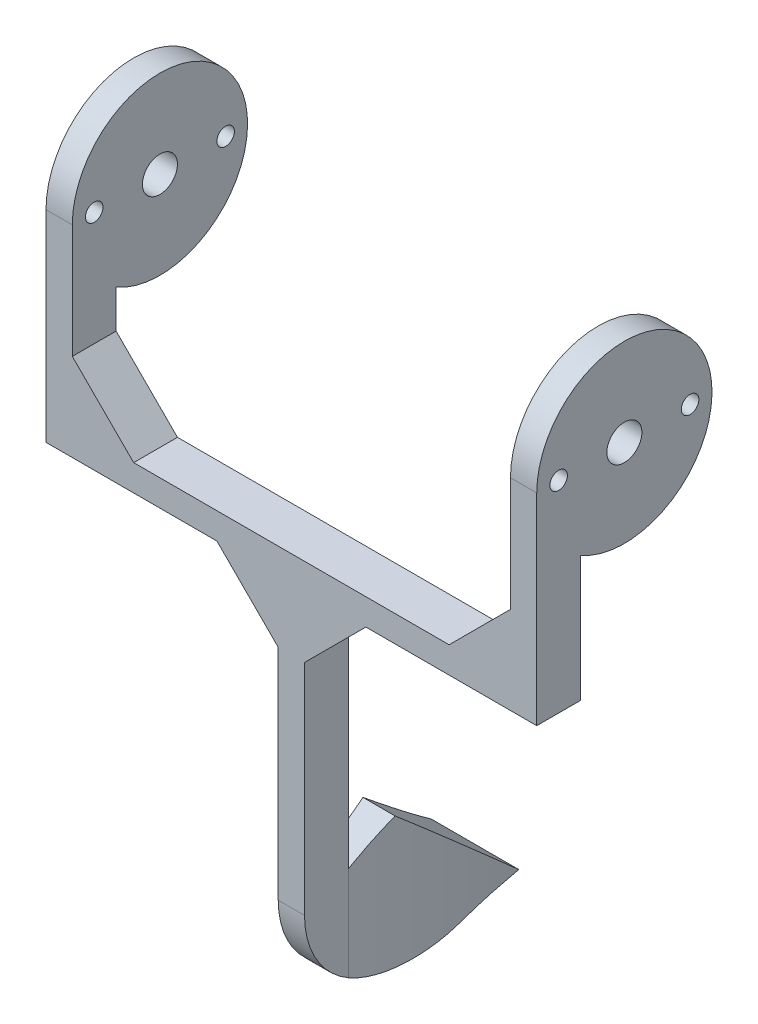
from build123d import *

# Parameters (mm, degrees)
BOSS_EXTRUDE1_DEPTH = 10
SKETCH2_OUTSIDE_W   = 35.602
SKETCH2_OUTSIDE_H   = 48.602
SKETCH2_OUTSIDE_R   = 2
CUT_EXTRUDE1_DEPTH  = 65.311741
SKETCH3_OUTSIDE_W   = 35.602
SKETCH3_OUTSIDE_H   = 48.602
CUT_EXTRUDE2_DEPTH  = 65.311741
BOSS_EXTRUDE2_DEPTH = 1.5
BOSS_EXTRUDE3_DEPTH = 5
SKETCH6_OUTSIDE_W   = 77.184
SKETCH6_OUTSIDE_H   = 42.134
CUT_EXTRUDE3_DEPTH  = 52.651745
SKETCH7_R           = 1
CUT_EXTRUDE4_DEPTH  = 73.669821
BOSS_EXTRUDE4_DEPTH = 5


with BuildPart() as part:
    # Sketch1 → Boss-Extrude1 (new, symmetric)
    with BuildSketch(Plane.XY):
        Polygon((0, 0), (-25, 0), (-25, 30), (-28, 30), (-28, -3), (0, -3), (28, -3), (28, 30), (25, 30), (25, 0), align=None)
    extrude(amount=BOSS_EXTRUDE1_DEPTH, both=True)

    # Sketch2 outside → Cut-Extrude1 (cut, through all)
    # profile 1 of 2: a face of its own
    with BuildSketch(Plane.ZY.offset(28)):
        with Locations((0, 13.5)):
            Rectangle(SKETCH2_OUTSIDE_W, SKETCH2_OUTSIDE_H)
        with BuildLine():
            Line((10, -3), (-10, -3))
            Line((-10, -3), (-10, 20))
            ThreePointArc((-10, 20), (0, 30), (10, 20))
            Line((10, 20), (10, -3))
        make_face(mode=Mode.SUBTRACT)
    # profile 2 of 2: a face of its own
    with BuildSketch(Plane.ZY.offset(28)):
        with Locations((0, 20)):
            Circle(SKETCH2_OUTSIDE_R)
    extrude(amount=-CUT_EXTRUDE1_DEPTH, mode=Mode.SUBTRACT)

    # Sketch3 outside → Cut-Extrude2 (cut, through all)
    with BuildSketch(Plane(origin=(28, 0, 0), x_dir=(0, 0, -1), z_dir=(1, 0, 0))):
        with Locations((0, 13.5)):
            Rectangle(SKETCH3_OUTSIDE_W, SKETCH3_OUTSIDE_H)
        with BuildLine():
            Line((-5, 11.339746), (-5, -3))
            Line((-5, -3), (-10, -3))
            Line((-10, -3), (-10, 20))
            ThreePointArc((-10, 20), (8.660254, 25), (-5, 11.339746))
        make_face(mode=Mode.SUBTRACT)
    extrude(amount=-CUT_EXTRUDE2_DEPTH, mode=Mode.SUBTRACT)

    # Sketch4 → Boss-Extrude2 (add, symmetric)
    with BuildSketch(Plane(origin=(0, 0, 0), x_dir=(0, 0, -1), z_dir=(1, 0, 0))):
        with BuildLine():
            Line((-10, -3), (-5, -3))
            Line((-5, -3), (-5, -32.886751))
            Line((-5, -32.886751), (0, -30))
            Line((0, -30), (0, -45))
            ThreePointArc((0, -45), (-7.071068, -42.071068), (-10, -35))
            Line((-10, -35), (-10, -3))
        make_face()
    extrude(amount=BOSS_EXTRUDE2_DEPTH, both=True)

    # Sketch5 → Boss-Extrude3 (add, symmetric)
    with BuildSketch(Plane(origin=(0, 0, 0), x_dir=(0, 0, -1), z_dir=(1, 0, 0))):
        with BuildLine():
            Line((0, -30), (-5, -32.886751))
            Line((-5, -32.886751), (-10, -32.886751))
            Line((-10, -32.886751), (-10, -35))
            ThreePointArc((-10, -35), (-4.414566, -43.972826), (6.102322, -42.922226))
            Line((6.102322, -42.922226), (10.950014, -39.188153))
            Line((10.950014, -39.188153), (0, -30))
        make_face()
    extrude(amount=BOSS_EXTRUDE3_DEPTH, both=True)

    # Sketch6 outside → Cut-Extrude3 (cut, through all)
    with BuildSketch(Plane.XZ.offset(3)):
        with Locations((0, -0.475)):
            Rectangle(SKETCH6_OUTSIDE_W, SKETCH6_OUTSIDE_H)
        with BuildLine():
            Line((-1.5, 10), (1.5, 10))
            Line((1.5, 10), (1.5, 5))
            ThreePointArc((1.5, 5), (2.385287, -3.164756), (5, -10.950014))
            Line((5, -10.950014), (-5, -10.950014))
            ThreePointArc((-5, -10.950014), (-2.385287, -3.164756), (-1.5, 5))
            Line((-1.5, 5), (-1.5, 10))
        make_face(mode=Mode.SUBTRACT)
    extrude(amount=CUT_EXTRUDE3_DEPTH, mode=Mode.SUBTRACT)

    # Sketch7 → Cut-Extrude4 (cut, through all)
    with BuildSketch(Plane(origin=(28, 0, 0), x_dir=(0, 0, -1), z_dir=(1, 0, 0))):
        with Locations((-7.5, 20)):
            Circle(SKETCH7_R)
        with Locations((7.5, 20)):
            Circle(SKETCH7_R)
    extrude(amount=-CUT_EXTRUDE4_DEPTH, mode=Mode.SUBTRACT)

    # Sketch8 → Boss-Extrude4 (add)
    with BuildSketch(Plane.XY.offset(10)):
        Polygon((-25, 0), (-25, 7), (-18, 0), align=None)
        Polygon((-8.5, -3), (-1.5, -3), (-1.5, -10), align=None)
        Polygon((1.5, -10), (1.5, -3), (8.5, -3), align=None)
        Polygon((18, 0), (25, 0), (25, 7), align=None)
    extrude(amount=-BOSS_EXTRUDE4_DEPTH)


solid = part.part
